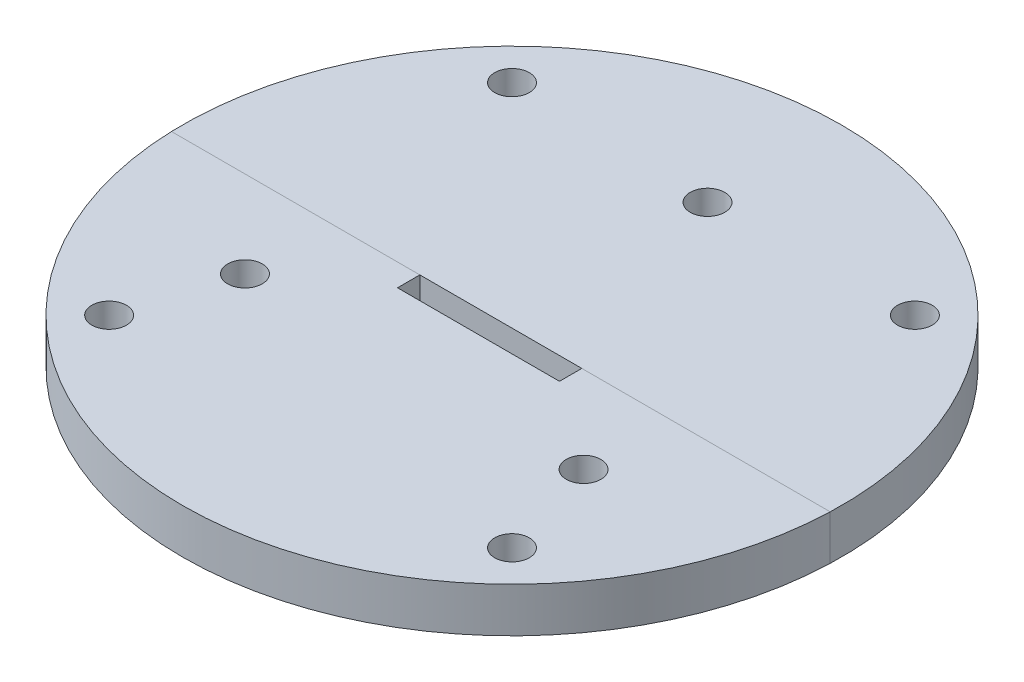
from build123d import *

# Parameters (mm, degrees)
SKETCH1_R              = 29.5
BOSS_EXTRUDE1_DEPTH    = 4
SKETCH2_R              = 1.55
CUT_EXTRUDE1_DEPTH     = 42.910619179
CIRPATTERN1_COUNT      = 4
SKETCH3_W              = 14.5
SKETCH3_H              = 2
CUT_EXTRUDE2_DEPTH     = 42.910619179
SKETCH9_R              = 1.55
CUT_EXTRUDE3_DEPTH     = 42.910619179
CIRPATTERN4_COUNT      = 3
SPLIT1_SURFACE_1_BACK  = 84.534
SPLIT1_SURFACE_1_DEPTH = 169.068
SPLIT1_SURFACE_2_BACK  = 84.534
SPLIT1_SURFACE_2_DEPTH = 169.068


with BuildPart() as part:
    # Sketch1 → Boss-Extrude1 (new body)
    with BuildSketch(Plane(origin=(0, 0, 0), x_dir=(1, 0, 0), z_dir=(0, 1, 0))):
        with Locations(Location((0, 0, 0), (0, 0, 270))):
            Circle(SKETCH1_R)
    extrude(amount=BOSS_EXTRUDE1_DEPTH)

    # Sketch2 → Cut-Extrude1 (cut, through all)
    with BuildSketch(Plane(origin=(0, 4, 0), x_dir=(1, 0, 0), z_dir=(0, 1, 0))):
        with Locations(Location((-18.03122292, 18.03122292, 0), (0, 0, 270))):
            Circle(SKETCH2_R)
    cut_extrude1 = extrude(amount=-CUT_EXTRUDE1_DEPTH, mode=Mode.SUBTRACT)

    # CirPattern1: Cut-Extrude1 ×4 about axis
    cirpattern1_axis = Axis((0, 0, 0), (0, 1, 0))
    for i in range(1, CIRPATTERN1_COUNT):
        add(cut_extrude1.rotate(cirpattern1_axis, i * 360 / CIRPATTERN1_COUNT), mode=Mode.SUBTRACT)

    # Sketch3 → Cut-Extrude2 (cut, through all)
    with BuildSketch(Plane(origin=(0, 4, 0), x_dir=(1, 0, 0), z_dir=(0, 1, 0))):
        with Locations((0, -2)):
            Rectangle(SKETCH3_W, SKETCH3_H)
    extrude(amount=-CUT_EXTRUDE2_DEPTH, mode=Mode.SUBTRACT)

    # Sketch9 → Cut-Extrude3 (cut, through all)
    with BuildSketch(Plane(origin=(0, 4, 0), x_dir=(1, 0, 0), z_dir=(0, 1, 0))):
        with Locations(Location((0, 17.5, 0), (0, 0, 270))):
            Circle(SKETCH9_R)
    cut_extrude3 = extrude(amount=-CUT_EXTRUDE3_DEPTH, mode=Mode.SUBTRACT)

    # CirPattern4: Cut-Extrude3 ×3 about axis
    cirpattern4_axis = Axis((0, 0, 0), (0, 1, 0))
    for i in range(1, CIRPATTERN4_COUNT):
        add(cut_extrude3.rotate(cirpattern4_axis, i * 360 / CIRPATTERN4_COUNT), mode=Mode.SUBTRACT)


with BuildPart() as body_2:
    # Split1: the piece behind the surface
    add(part.part)
    # Split1 surface: a surface, the sketch's curves swept straight by 169.068 mm
    with BuildLine(Plane(origin=(0, 0, 0), x_dir=(1, 0, 0), z_dir=(0, 1, 0)).offset(-SPLIT1_SURFACE_1_BACK), mode=Mode.PRIVATE) as split1_surface_1_path:
        Line((-30.661720474, -1), (30.661720474, -1))
    split1_surface_1 = Shell.extrude(split1_surface_1_path.wire(), (0 * SPLIT1_SURFACE_1_DEPTH, 1 * SPLIT1_SURFACE_1_DEPTH, 0 * SPLIT1_SURFACE_1_DEPTH))
    split(bisect_by=split1_surface_1, keep=Keep.BOTTOM)


with BuildPart() as part_1:
    add(part.part)

    # Split1: split by a surface, the side it looks to stays
    # Split1 surface: a surface, the sketch's curves swept straight by 169.068 mm
    with BuildLine(Plane(origin=(0, 0, 0), x_dir=(1, 0, 0), z_dir=(0, 1, 0)).offset(-SPLIT1_SURFACE_2_BACK), mode=Mode.PRIVATE) as split1_surface_2_path:
        Line((-30.661720474, -1), (30.661720474, -1))
    split1_surface_2 = Shell.extrude(split1_surface_2_path.wire(), (0 * SPLIT1_SURFACE_2_DEPTH, 1 * SPLIT1_SURFACE_2_DEPTH, 0 * SPLIT1_SURFACE_2_DEPTH))
    split(bisect_by=split1_surface_2, keep=Keep.TOP)


solid = Compound([body_2.part, part_1.part])
